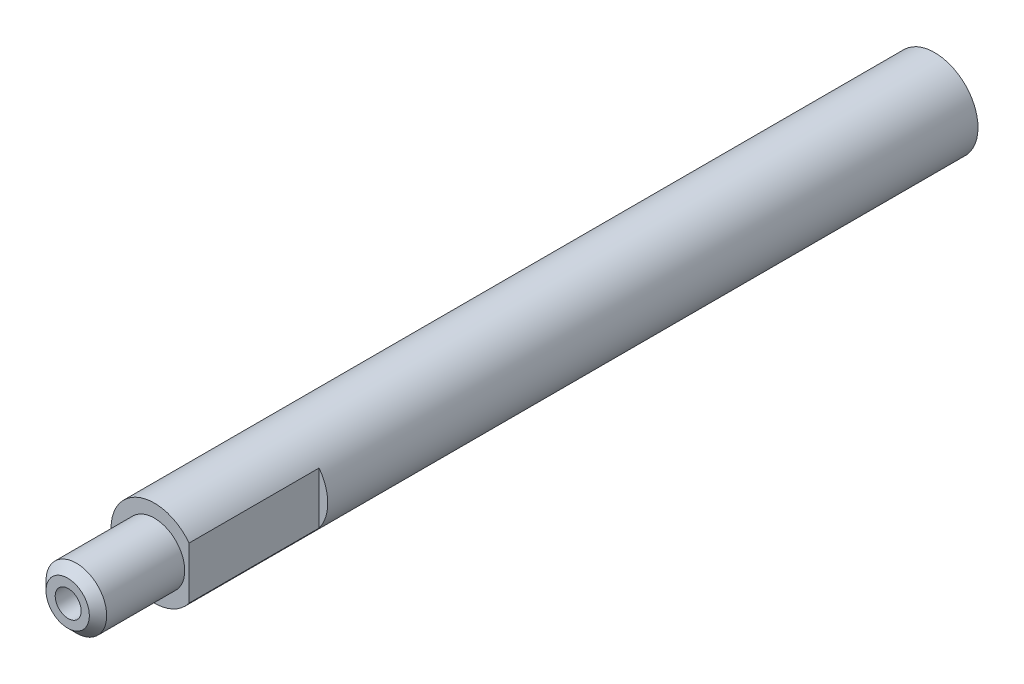
from build123d import *

# Parameters (mm, degrees)
SKETCH15_R         = 5
BASE_EXTRUDE_DEPTH = 100
SKETCH24_OUTSIDE_W = 32.2
SKETCH24_OUTSIDE_H = 32.2
SKETCH24_OUTSIDE_R = 3.5
FRONT_CUT_DEPTH    = 10
FRONT_HOLE_D       = 3
FRONT_HOLE_DEPTH   = 10
FRONT_HOLE_TIP     = 0.901290929
CHAMFER1_SIZE      = 1
KEYWAY_CUT_START   = -25
KEYWAY_CUT_DEPTH   = 25
BACK_HOLE_D        = 4
BACK_HOLE_DEPTH    = 10
BACK_HOLE_TIP      = 1.201721238


with BuildPart() as part:
    # Sketch15 → Base Extrude (new body)
    with BuildSketch(Plane.XY):
        Circle(SKETCH15_R)
    extrude(amount=BASE_EXTRUDE_DEPTH)

    # Sketch24 outside → Front Cut (cut)
    with BuildSketch(Plane.XY.offset(100)):
        Rectangle(SKETCH24_OUTSIDE_W, SKETCH24_OUTSIDE_H)
        Circle(SKETCH24_OUTSIDE_R, mode=Mode.SUBTRACT)
    extrude(amount=-FRONT_CUT_DEPTH, mode=Mode.SUBTRACT)

    # Front Hole
    with Locations(Plane(origin=(0.062150556, -0.00731183, 100), x_dir=(1, 0, 0), z_dir=(0, 0, 1))):
        with Locations((0, 0)):
            Hole(FRONT_HOLE_D / 2, depth=FRONT_HOLE_DEPTH)
            with Locations((0, 0, -(FRONT_HOLE_DEPTH + FRONT_HOLE_TIP / 2))):  # 118° drill point
                Cone(0, FRONT_HOLE_D / 2, FRONT_HOLE_TIP, mode=Mode.SUBTRACT)

    # Chamfer1
    chamfer1_edges = [part.edges().sort_by_distance(p)[0] for p in [
        (-3.5, 0, 100),
    ]]
    chamfer(chamfer1_edges, length=CHAMFER1_SIZE)

    # Keyway → Keyway-Cut (cut)
    with BuildSketch(Plane.XY.offset(100).offset(KEYWAY_CUT_START)):
        with BuildLine():
            ThreePointArc((5, 0), (4.74341649, 1.58113883), (4, 3))
            Line((4, 3), (4, -3))
            ThreePointArc((4, -3), (4.74341649, -1.58113883), (5, 0))
        make_face()
    extrude(amount=KEYWAY_CUT_DEPTH, mode=Mode.SUBTRACT)

    # Back Hole
    with Locations(Plane(origin=(0, 0, 0), x_dir=(-1, 0, 0), z_dir=(0, 0, -1))):
        with Locations((0, 0)):
            Hole(BACK_HOLE_D / 2, depth=BACK_HOLE_DEPTH)
            with Locations((0, 0, -(BACK_HOLE_DEPTH + BACK_HOLE_TIP / 2))):  # 118° drill point
                Cone(0, BACK_HOLE_D / 2, BACK_HOLE_TIP, mode=Mode.SUBTRACT)


solid = part.part
